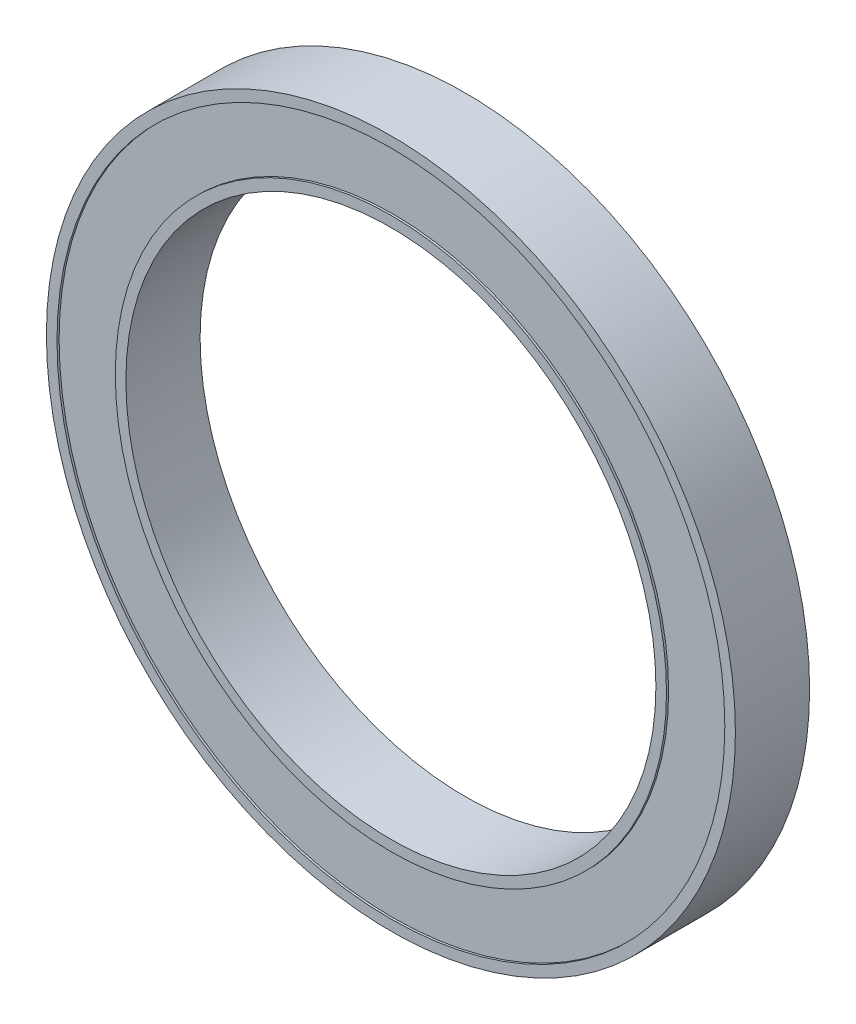
from build123d import *

# Parameters (mm, degrees)
SKETCH1_R          = 26
SKETCH1_R_2        = 25
EXTRUSION1_DEPTH   = 7
SKETCH1_R_3        = 32.5
SKETCH1_R_4        = 31.5
EXTRUSION1_2_DEPTH = 7
SKETCH2_R          = 31.5
SKETCH2_R_2        = 26
EXTRUSION2_DEPTH   = 6.6


with BuildPart() as part:
    # Sketch1 → Extrusion1 (new body)
    with BuildSketch(Plane.XY):
        Circle(SKETCH1_R)
        Circle(SKETCH1_R_2, mode=Mode.SUBTRACT)
    extrude(amount=EXTRUSION1_DEPTH)



with BuildPart() as body_2:
    # Sketch1 → Extrusion1 2 (new body)
    with BuildSketch(Plane.XY):
        Circle(SKETCH1_R_3)
        Circle(SKETCH1_R_4, mode=Mode.SUBTRACT)
    extrude(amount=EXTRUSION1_2_DEPTH)


with BuildPart() as part_1:
    add(part.part)

    add(body_2.part)  # Extrusion2 merges body 2
    # Sketch2 → Extrusion2 (add)
    with BuildSketch(Plane.XY.offset(0.2)):
        Circle(SKETCH2_R)
        Circle(SKETCH2_R_2, mode=Mode.SUBTRACT)
    extrude(amount=EXTRUSION2_DEPTH)


solid = part_1.part
